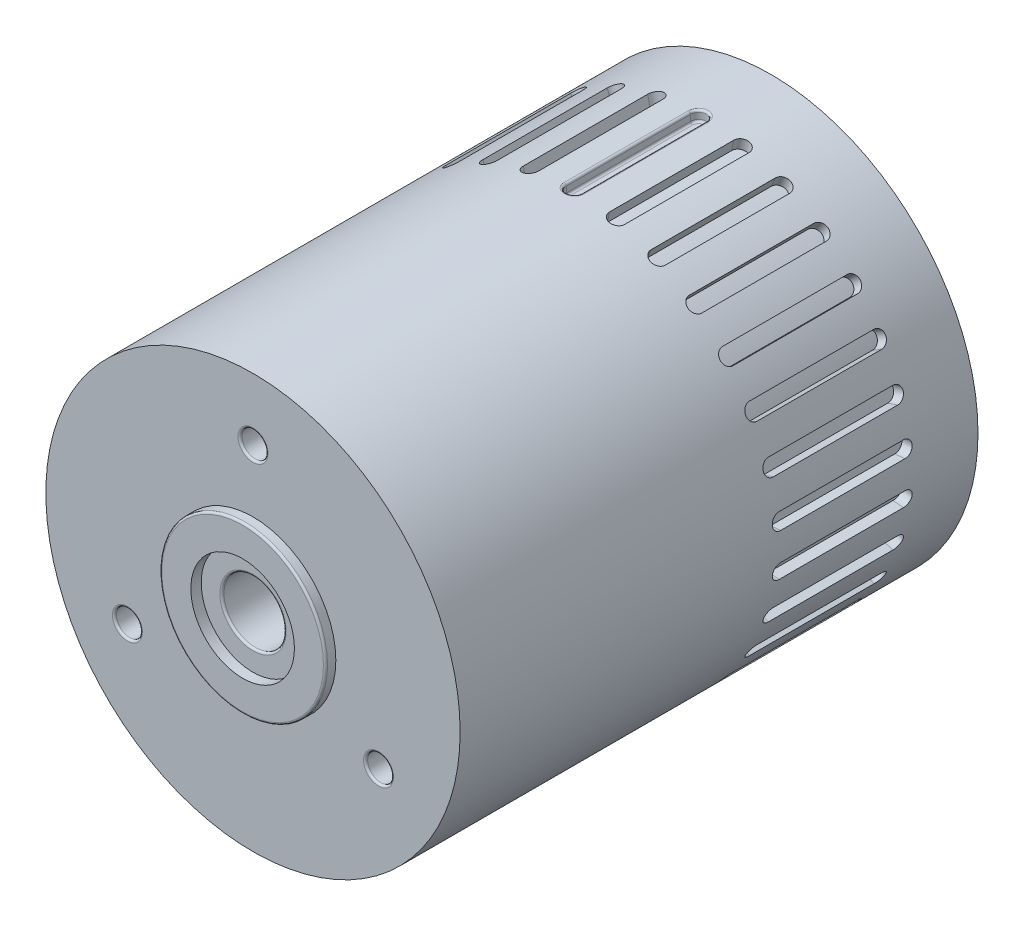
from build123d import *

# Parameters (mm, degrees)
SKETCH1_R               = 10
BOSS_EXTRUDE1_DEPTH     = 25
SKETCH4_R               = 4
SKETCH4_R_2             = 2.5
BOSS_EXTRUDE2_DEPTH     = 0.5
SKETCH5_R               = 1.5
BOSS_EXTRUDE3_DEPTH     = 0.5
CUT_EXTRUDE3_REACH      = 61.159
CUT_EXTRUDE3_END_RADIUS = 9.5
CUT_EXTRUDE3_START      = 30
FILLET1_R               = 0.1
CIRPATTERN3_COUNT       = 30
SKETCH10_R              = 1.5
CUT_EXTRUDE4_DEPTH      = 5.75
SKETCH14_R              = 0.625
CUT_EXTRUDE5_DEPTH      = 5
FILLET2_R               = 0.1


with BuildPart() as part:
    # Sketch1 → Boss-Extrude1 (new body)
    with BuildSketch(Plane.XY):
        Circle(SKETCH1_R)
    extrude(amount=-BOSS_EXTRUDE1_DEPTH)

    # Sketch4 → Boss-Extrude2 (add)
    with BuildSketch(Plane.XY):
        Circle(SKETCH4_R)
        Circle(SKETCH4_R_2, mode=Mode.SUBTRACT)
    extrude(amount=BOSS_EXTRUDE2_DEPTH)

    # Sketch5 → Boss-Extrude3 (add)
    with BuildSketch(Plane(origin=(0, 0, -25), x_dir=(-1, 0, 0), z_dir=(0, 0, -1))):
        Circle(SKETCH5_R)
    extrude(amount=BOSS_EXTRUDE3_DEPTH)

    # Cut-Extrude3: up to this cylinder (the profile starts outside it)
    cut_extrude3_end = Plane(origin=(0, 0, -18.5), z_dir=(0, 0, 1)) * Cylinder(CUT_EXTRUDE3_END_RADIUS, 142.318, mode=Mode.PRIVATE)
    # Sketch9 → Cut-Extrude3 (cut, up to the surface)
    with BuildSketch(Plane(origin=(0, 0, 0), x_dir=(1, 0, 0), z_dir=(0, 1, 0)).offset(CUT_EXTRUDE3_START), mode=Mode.PRIVATE) as cut_extrude3_sk1:
        with BuildLine():
            Line((0.375, 21.5), (0.375, 15.5))
            ThreePointArc((0.375, 15.5), (0, 15.125), (-0.375, 15.5))
            Line((-0.375, 15.5), (-0.375, 21.5))
            ThreePointArc((-0.375, 21.5), (0, 21.875), (0.375, 21.5))
        make_face()
    cut_extrude3_tool1 = extrude(cut_extrude3_sk1.sketch, amount=-CUT_EXTRUDE3_REACH, mode=Mode.PRIVATE) - cut_extrude3_end
    cut_extrude3 = cut_extrude3_tool1.solids().sort_by_distance((0, 30, -18.5))[0]
    add(cut_extrude3, mode=Mode.SUBTRACT)

    # Fillet1
    fillet1_edges = [part.edges().sort_by_distance(p)[0] for p in [
        (0, 10, -21.875),
        (0.375, 9.992966276, -18.5),
        (0, 10, -15.125),
        (-0.375, 9.992966276, -18.5),
        (0, 9.5, -21.875),
        (0.375, 9.492595799, -18.5),
        (0, 9.5, -15.125),
        (-0.375, 9.492595799, -18.5),
    ]]
    fillet(fillet1_edges, radius=FILLET1_R)

    # CirPattern3: Cut-Extrude3 ×30 about axis
    cirpattern3_axis = Axis((0, 0, 0), (0, 0, 1))
    for i in range(1, CIRPATTERN3_COUNT):
        add(cut_extrude3.rotate(cirpattern3_axis, i * 360 / CIRPATTERN3_COUNT), mode=Mode.SUBTRACT)

    # Sketch10 → Cut-Extrude4 (cut)
    with BuildSketch(Plane.XY):
        with Locations(Location((0, 0, 0), (0, 0, 180))):
            Circle(SKETCH10_R)
    extrude(amount=-CUT_EXTRUDE4_DEPTH, mode=Mode.SUBTRACT)

    # Sketch14 → Cut-Extrude5 (cut)
    with BuildSketch(Plane.XY):
        with Locations((0, 7)):
            Circle(SKETCH14_R)
        with Locations((6.062177826, -3.5)):
            Circle(SKETCH14_R)
        with Locations((-6.062177826, -3.5)):
            Circle(SKETCH14_R)
    extrude(amount=-CUT_EXTRUDE5_DEPTH, mode=Mode.SUBTRACT)

    # Fillet2
    fillet2_edges = [part.edges().sort_by_distance(p)[0] for p in [
        (1.5, 0, -25.5),
        (1.5, 0, 0),
        (-0.625, 7, 0),
        (5.437177826, -3.5, 0),
        (-6.687177826, -3.5, 0),
        (-4, 0, 0.5),
    ]]
    fillet(fillet2_edges, radius=FILLET2_R)


solid = part.part
